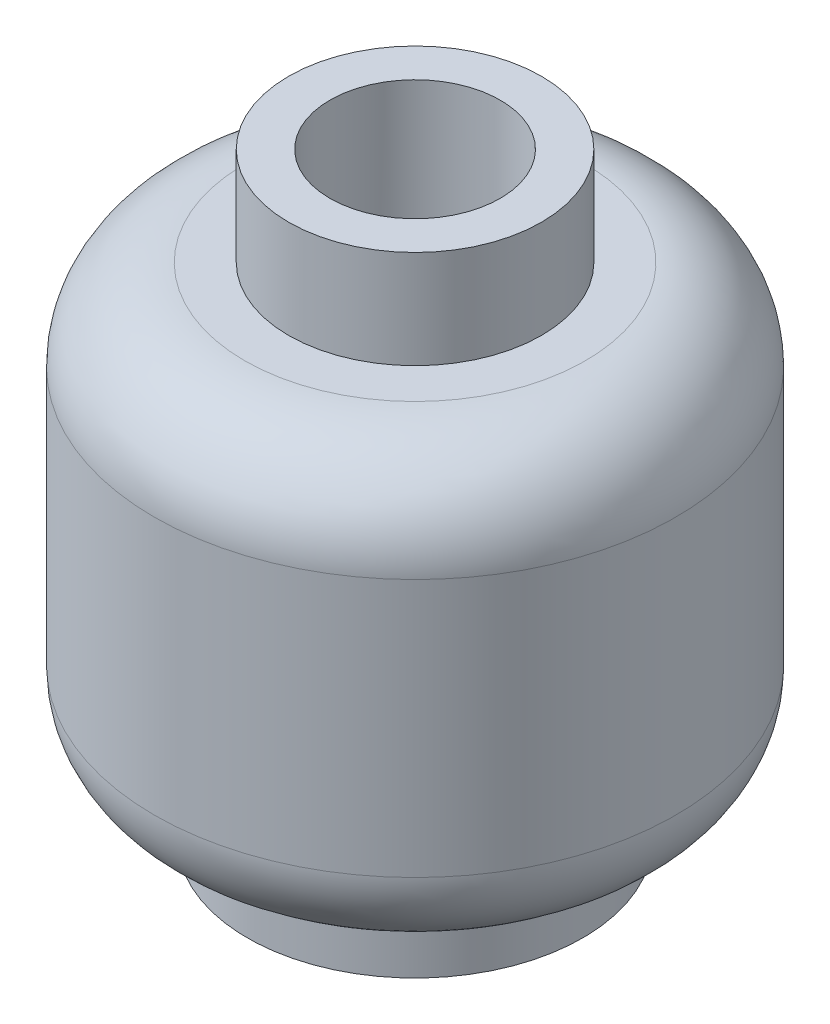
from build123d import *

# Parameters (mm, degrees)
SKETCH1_R           = 3.25
BOSS_EXTRUDE1_DEPTH = 1.21
SKETCH2_R           = 5.05
BOSS_EXTRUDE2_DEPTH = 8.5
SKETCH3_R           = 2.45
BOSS_EXTRUDE3_DEPTH = 1.9
FILLET1_R           = 1.75
FILLET2_R           = 1.75
SKETCH4_R           = 1.65
CUT_EXTRUDE1_DEPTH  = 14.630740992
SKETCH5_R           = 2.45
CUT_EXTRUDE3_DEPTH  = 8.6


with BuildPart() as part:
    # Sketch1 → Boss-Extrude1 (new body)
    with BuildSketch(Plane(origin=(0, 0, 0), x_dir=(1, 0, 0), z_dir=(0, 1, 0))):
        with Locations(Location((0, 0, 0), (0, 0, 90))):
            Circle(SKETCH1_R)
    extrude(amount=BOSS_EXTRUDE1_DEPTH)

    # Sketch2 → Boss-Extrude2 (add)
    with BuildSketch(Plane(origin=(0, 1.21, 0), x_dir=(1, 0, 0), z_dir=(0, 1, 0))):
        with Locations(Location((0, 0, 0), (0, 0, 270))):
            Circle(SKETCH2_R)
    extrude(amount=BOSS_EXTRUDE2_DEPTH)

    # Sketch3 → Boss-Extrude3 (add)
    with BuildSketch(Plane(origin=(0, 9.71, 0), x_dir=(1, 0, 0), z_dir=(0, 1, 0))):
        with Locations(Location((0, 0, 0), (0, 0, 90))):
            Circle(SKETCH3_R)
    extrude(amount=BOSS_EXTRUDE3_DEPTH)

    # Fillet1
    fillet1_edges = [part.edges().sort_by_distance(p)[0] for p in [
        (0, 9.71, -5.05),
    ]]
    fillet(fillet1_edges, radius=FILLET1_R)

    # Fillet2
    fillet2_edges = [part.edges().sort_by_distance(p)[0] for p in [
        (0, 1.21, -5.05),
    ]]
    fillet(fillet2_edges, radius=FILLET2_R)

    # Sketch4 → Cut-Extrude1 (cut, through all)
    with BuildSketch(Plane(origin=(0, 11.61, 0), x_dir=(1, 0, 0), z_dir=(0, 1, 0))):
        with Locations(Location((0, 0, 0), (0, 0, 270))):
            Circle(SKETCH4_R)
    extrude(amount=-CUT_EXTRUDE1_DEPTH, mode=Mode.SUBTRACT)

    # Sketch5 → Cut-Extrude3 (cut)
    with BuildSketch(Plane.XZ):
        with Locations(Location((0, 0, 0), (0, 0, 270))):
            Circle(SKETCH5_R)
    extrude(amount=-CUT_EXTRUDE3_DEPTH, mode=Mode.SUBTRACT)


solid = part.part
